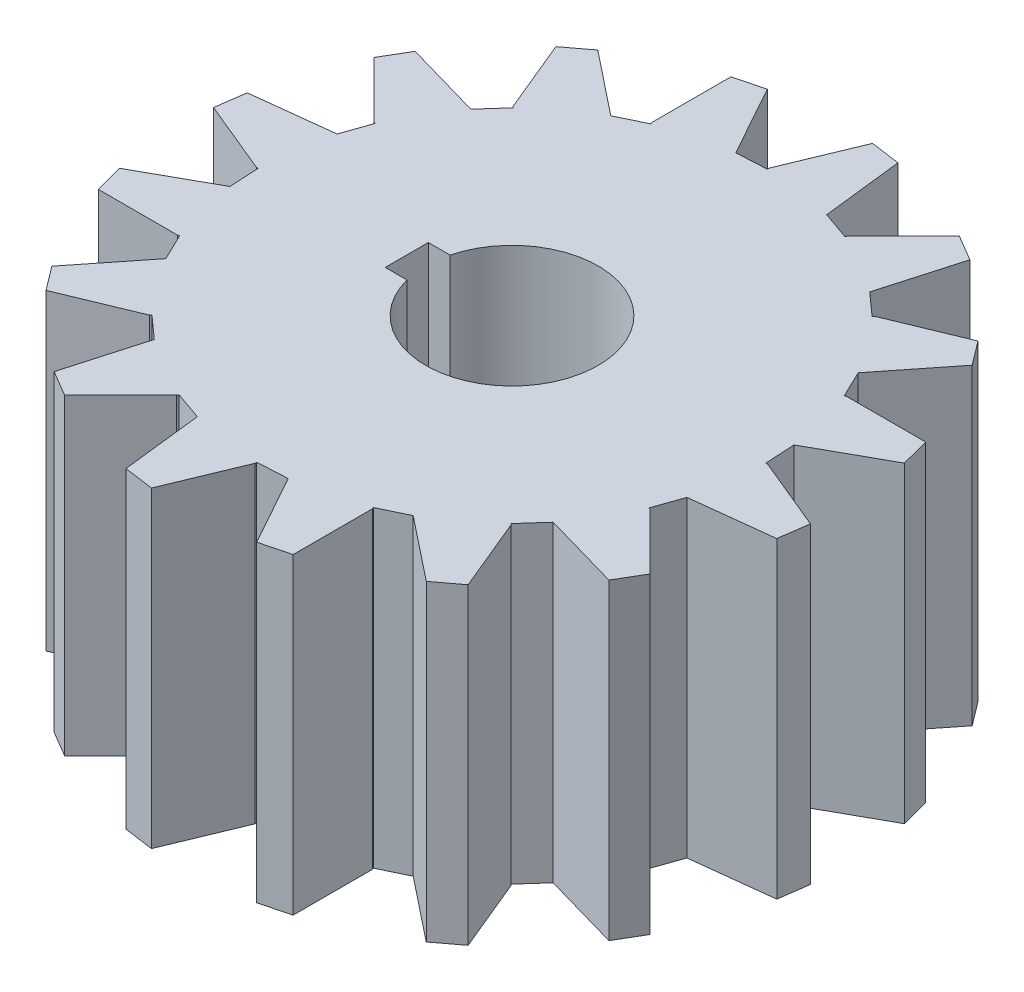
from build123d import *

# Parameters (mm, degrees)
ENL_V_MAT_EXTRU_3_DEPTH      = 285.465287865
R_P_TITION_CIRCULAIRE1_COUNT = 16
ENL_V_MAT_EXTRU_4_DEPTH      = 83.627706895


with BuildPart() as part:
    # Esquisse1 → Révolution1 (revolve)
    with BuildSketch(Plane.XY):
        Polygon((-198.5, 46), (-198.5, 0), (-150, 0), (0, 0), (0, 46), (-150, 46), align=None)
    revolve(axis=Axis((0, 46, 0), (0, -1, 0)))

    # Esquisse5 → Enlèv. mat.-Extru.3 (cut, through all)
    with BuildSketch(Plane(origin=(0, 46, 0), x_dir=(1, 0, 0), z_dir=(0, 1, 0))):
        Polygon((-37.5, 0), (-48.53523435, 4.570943732), (-47.92540835, 8.928478843), (-36.059319151, 10.294440362), (-34.605302242, 14.447250836), (-202.600479892, 84.582990546), (-207.961569477, 0), align=None)
    enl_v_mat_extru_3 = extrude(amount=-ENL_V_MAT_EXTRU_3_DEPTH, mode=Mode.SUBTRACT)

    # Répétition circulaire1: Enlèv. mat.-Extru.3 ×16 about axis
    r_p_tition_circulaire1_axis = Axis((0, 39.3, 0), (0, -1, 0))
    for i in range(1, R_P_TITION_CIRCULAIRE1_COUNT):
        add(enl_v_mat_extru_3.rotate(r_p_tition_circulaire1_axis, i * 360 / R_P_TITION_CIRCULAIRE1_COUNT), mode=Mode.SUBTRACT)

    # Esquisse6 → Enlèv. mat.-Extru.4 (cut, through all)
    with BuildSketch(Plane(origin=(0, 46, 0), x_dir=(1, 0, 0), z_dir=(0, 1, 0))):
        with BuildLine():
            Line((-12.296722124, 3.175), (-15.496722124, 3.175))
            Line((-15.496722124, 3.175), (-15.496722124, -3.175))
            Line((-15.496722124, -3.175), (-12.296722124, -3.175))
            ThreePointArc((-12.296722124, -3.175), (12.7, 0), (-12.296722124, 3.175))
        make_face()
    extrude(amount=-ENL_V_MAT_EXTRU_4_DEPTH, mode=Mode.SUBTRACT)


solid = part.part
